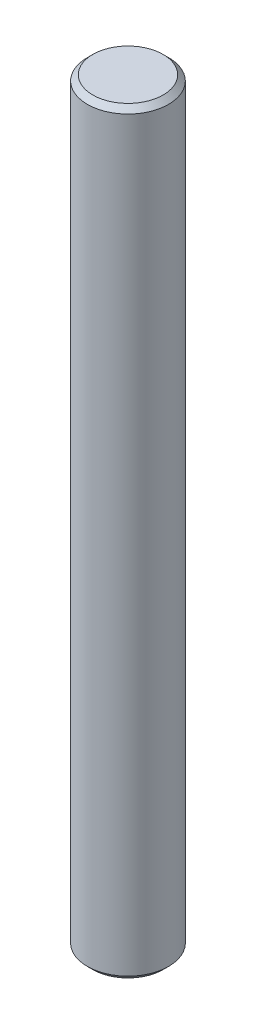
from build123d import *

# Parameters (mm, degrees)
SKETCH1_R           = 1.5
BOSS_EXTRUDE1_DEPTH = 14
CHAMFER1_SIZE       = 0.2


with BuildPart() as part:
    # Sketch1 → Boss-Extrude1 (new, symmetric)
    with BuildSketch(Plane(origin=(0, 0, 0), x_dir=(1, 0, 0), z_dir=(0, 1, 0))):
        with Locations(Location((0, 0, 0), (0, 0, 270))):
            Circle(SKETCH1_R)
    extrude(amount=BOSS_EXTRUDE1_DEPTH, both=True)

    # Chamfer1
    chamfer1_edges = [part.edges().sort_by_distance(p)[0] for p in [
        (0, -14, -1.5),
        (0, 14, -1.5),
    ]]
    chamfer(chamfer1_edges, length=CHAMFER1_SIZE)


solid = part.part
